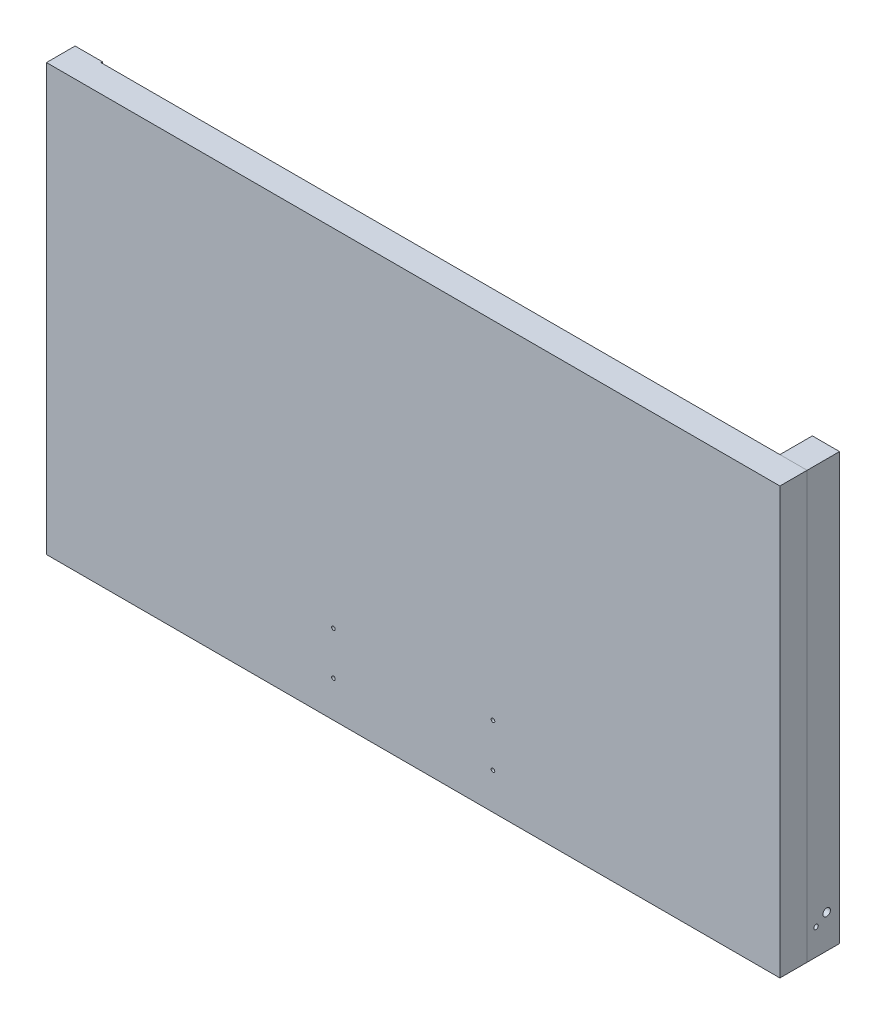
from build123d import *

# Parameters (mm, degrees)
CROQUIS1_W              = 509.67
CROQUIS1_H              = 296.1
SALIENTE_EXTRUIR1_DEPTH = 18.9
CROQUIS3_W              = 22.537538862
CROQUIS3_H              = 296.1
CROQUIS3_R              = 1.575
CROQUIS3_R_2            = 2.6
SALIENTE_EXTRUIR2_DEPTH = 18.9
CROQUIS9_W              = 18.9
CROQUIS9_H              = 296.1
SALIENTE_EXTRUIR6_DEPTH = 1
CROQUIS11_R             = 1.265
CORTAR_EXTRUIR2_DEPTH   = 591.894058632


with BuildPart() as part:
    # Croquis1 → Saliente-Extruir1 (new body)
    with BuildSketch(Plane.XY):
        with Locations((254.835, 148.05)):
            Rectangle(CROQUIS1_W, CROQUIS1_H)
    extrude(amount=SALIENTE_EXTRUIR1_DEPTH)

    # Croquis9 → Saliente-Extruir6 (add)
    with BuildSketch(Plane(origin=(0, 0, 0), x_dir=(-1, 0, 0), z_dir=(0, 0, -1))):
        with Locations((-9.45, 148.05)):
            Rectangle(CROQUIS9_W, CROQUIS9_H)
    extrude(amount=SALIENTE_EXTRUIR6_DEPTH)

    # Croquis11 → Cortar-Extruir2 (cut, through all)
    with BuildSketch(Plane.XY.offset(18.9)):
        with Locations((310.28, 55.349717972)):
            Circle(CROQUIS11_R)
        with Locations((310.28, 25.349717972)):
            Circle(CROQUIS11_R)
        with Locations(Location((199.39, 25.349717972, 0), (0, 0, 180))):
            Circle(CROQUIS11_R)
        with Locations(Location((199.39, 55.349717972, 0), (0, 0, 180))):
            Circle(CROQUIS11_R)
    extrude(amount=-CORTAR_EXTRUIR2_DEPTH, mode=Mode.SUBTRACT)


with BuildPart() as body_2:
    # Croquis3 → Saliente-Extruir2 (new body)
    with BuildSketch(Plane(origin=(509.67, 0, 0), x_dir=(0, 0, -1), z_dir=(1, 0, 0))):
        with Locations((11.268769431, 148.05)):
            Rectangle(CROQUIS3_W, CROQUIS3_H)
        with Locations((6.195860675, 18.153754462)):
            Circle(CROQUIS3_R, mode=Mode.SUBTRACT)
        with Locations((13.568229074, 23.31594239)):
            Circle(CROQUIS3_R_2, mode=Mode.SUBTRACT)
    extrude(amount=-SALIENTE_EXTRUIR2_DEPTH)


solid = Compound([part.part, body_2.part])
